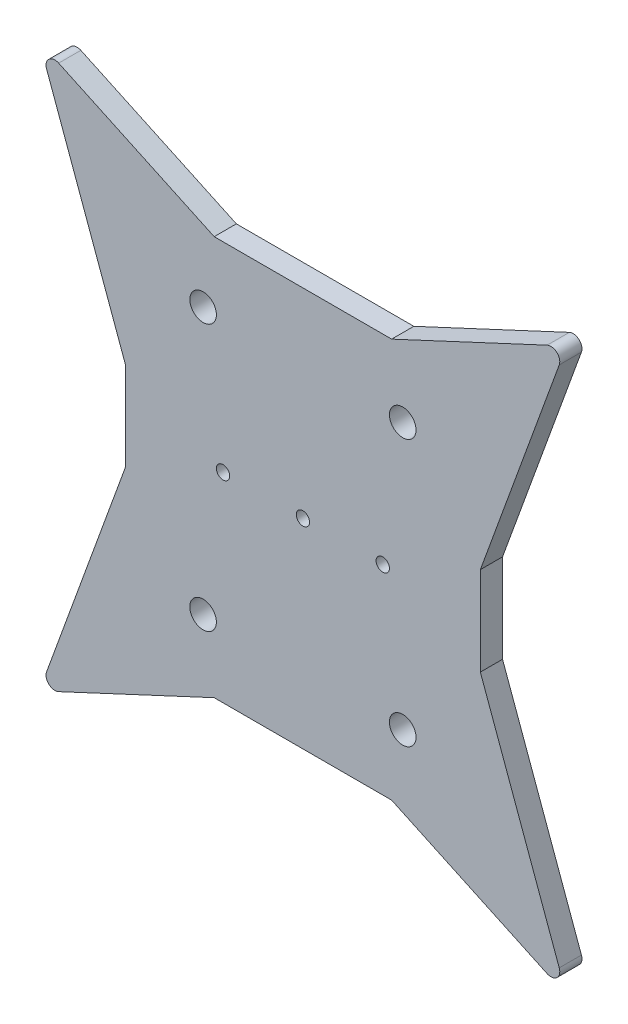
from build123d import *

# Parameters (mm, degrees)
SKETCH1_R           = 3
SKETCH1_R_2         = 1.5
BOSS_EXTRUDE1_DEPTH = 5
FILLET1_R           = 2


with BuildPart() as part:
    # Sketch1 → Boss-Extrude1 (new body)
    with BuildSketch(Plane.XY):
        Polygon((-20, 45), (20, 45), (59.431325943, 63.387129258), (40, 10), (40, -10), (59.431325943, -63.387129258), (20, -45), (-20, -45), (-59.431325943, -63.387129258), (-40, -10), (-40, 10), (-59.431325943, 63.387129258), align=None)
        with Locations((-22.5, 30)):
            Circle(SKETCH1_R, mode=Mode.SUBTRACT)
        Circle(SKETCH1_R_2, mode=Mode.SUBTRACT)
        with Locations((-18, 0)):
            Circle(SKETCH1_R_2, mode=Mode.SUBTRACT)
        with Locations((18, 0)):
            Circle(SKETCH1_R_2, mode=Mode.SUBTRACT)
        with Locations((22.5, 30)):
            Circle(SKETCH1_R, mode=Mode.SUBTRACT)
        with Locations((22.5, -30)):
            Circle(SKETCH1_R, mode=Mode.SUBTRACT)
        with Locations((-22.5, -30)):
            Circle(SKETCH1_R, mode=Mode.SUBTRACT)
    extrude(amount=BOSS_EXTRUDE1_DEPTH)

    # Fillet1
    fillet1_edges = [part.edges().sort_by_distance(p)[0] for p in [
        (59.431325943, 63.387129258, 2.5),
        (59.431325943, -63.387129258, 2.5),
        (-59.431325943, -63.387129258, 2.5),
        (-59.431325943, 63.387129258, 2.5),
    ]]
    fillet(fillet1_edges, radius=FILLET1_R)


solid = part.part
